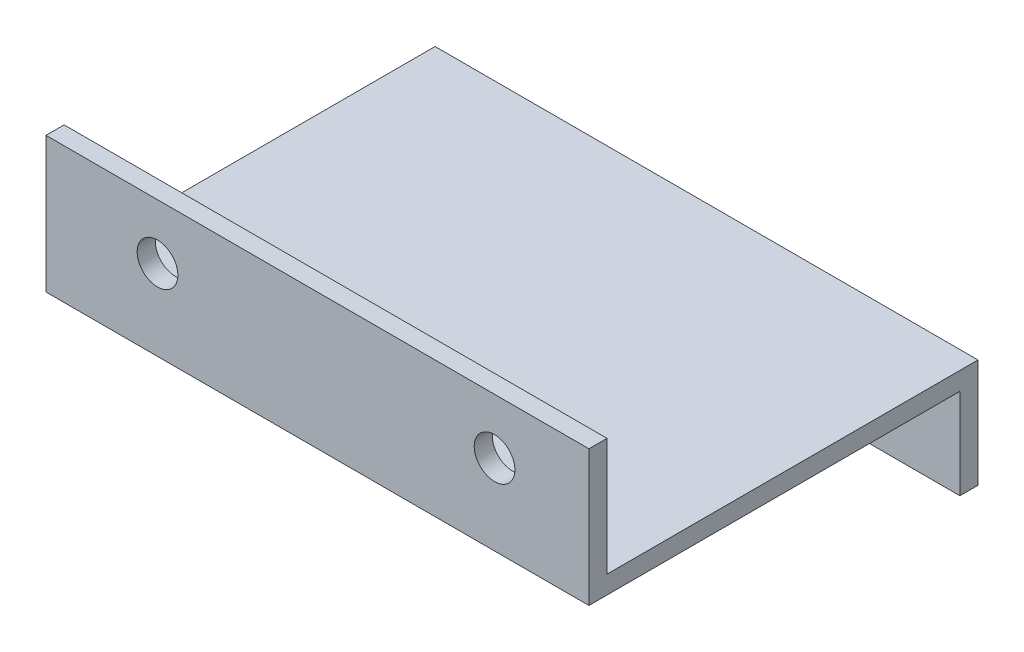
from build123d import *

# Parameters (mm, degrees)
SKETCH1_W            = 60
SKETCH1_H            = 20
BOSS_EXTRUDE1_DEPTH  = 43
SKETCH2_W            = 60
SKETCH2_H            = 8
CUT_EXTRUDE1_DEPTH   = 41
SKETCH3_W            = 60
SKETCH3_H            = 10
CUT_EXTRUDE2_DEPTH   = 41
SKETCH4_W            = 60
SKETCH4_H            = 2
BOSS_EXTRUDE2_DEPTH  = 5
M4_CLEARANCE_HOLE1_D = 4.5


with BuildPart() as part:
    # Sketch1 → Boss-Extrude1 (new body)
    with BuildSketch(Plane.XY):
        Rectangle(SKETCH1_W, SKETCH1_H)
    extrude(amount=BOSS_EXTRUDE1_DEPTH)

    # Sketch2 → Cut-Extrude1 (cut)
    with BuildSketch(Plane(origin=(0, 0, 0), x_dir=(-1, 0, 0), z_dir=(0, 0, -1))):
        with Locations((0, 6)):
            Rectangle(SKETCH2_W, SKETCH2_H)
    extrude(amount=-CUT_EXTRUDE1_DEPTH, mode=Mode.SUBTRACT)

    # Sketch3 → Cut-Extrude2 (cut)
    with BuildSketch(Plane.XY.offset(43)):
        with Locations((0, -5)):
            Rectangle(SKETCH3_W, SKETCH3_H)
    extrude(amount=-CUT_EXTRUDE2_DEPTH, mode=Mode.SUBTRACT)

    # Sketch4 → Boss-Extrude2 (add)
    with BuildSketch(Plane(origin=(0, 10, 0), x_dir=(1, 0, 0), z_dir=(0, 1, 0))):
        with Locations((0, -42)):
            Rectangle(SKETCH4_W, SKETCH4_H)
    extrude(amount=BOSS_EXTRUDE2_DEPTH)

    # M4 Clearance Hole1 (through all)
    with Locations(Plane(origin=(0, 0, 41), x_dir=(-1, 0, 0), z_dir=(0, 0, -1))):
        with Locations((-19.571160429, 8.893689212), (17.676175713, 8.893689212)):
            Hole(M4_CLEARANCE_HOLE1_D / 2)


solid = part.part
